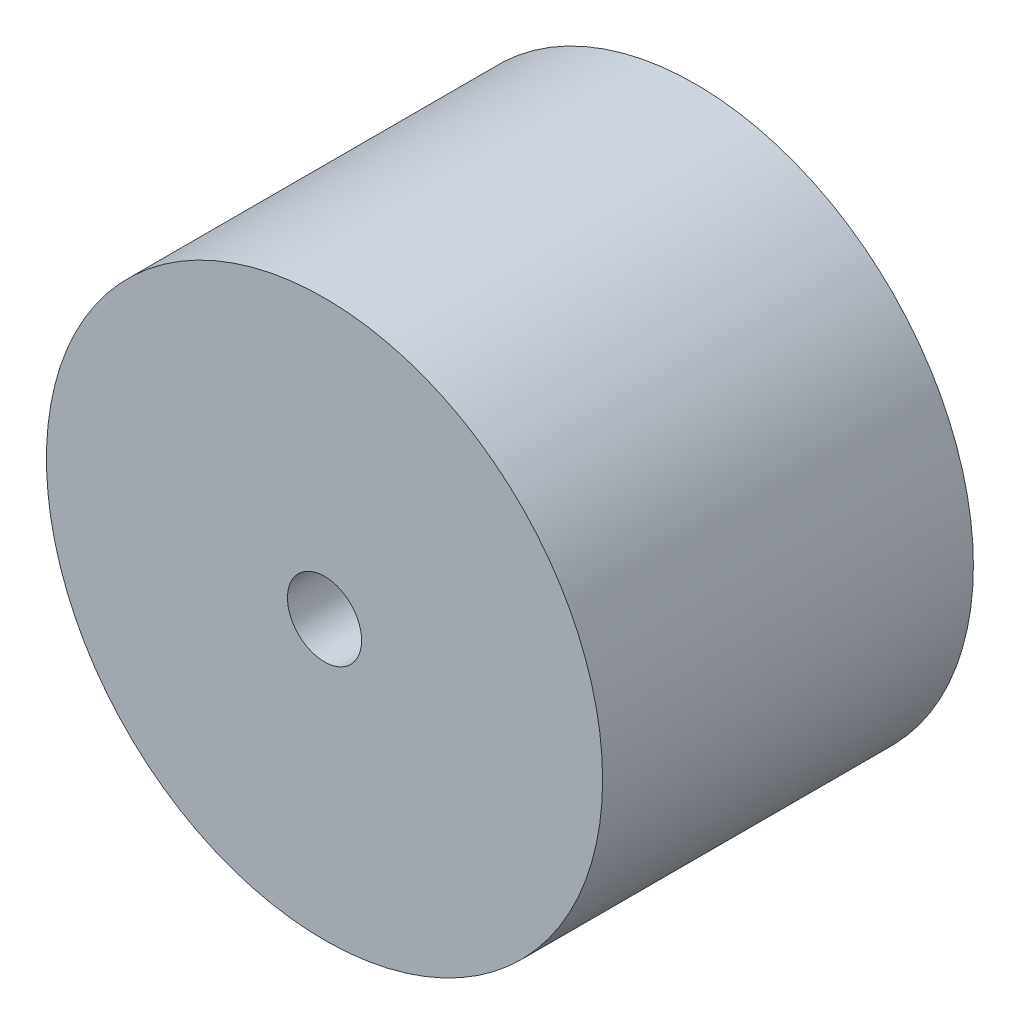
from build123d import *

# Parameters (mm, degrees)
SKETCH_1_R      = 15
SKETCH_1_R_2    = 2
EXTRUDE_1_DEPTH = 20


with BuildPart() as part:
    # 草图1 → 凸台-拉伸1 (new body)
    with BuildSketch(Plane.XY):
        Circle(SKETCH_1_R)
        Circle(SKETCH_1_R_2, mode=Mode.SUBTRACT)
    extrude(amount=EXTRUDE_1_DEPTH)


solid = part.part
